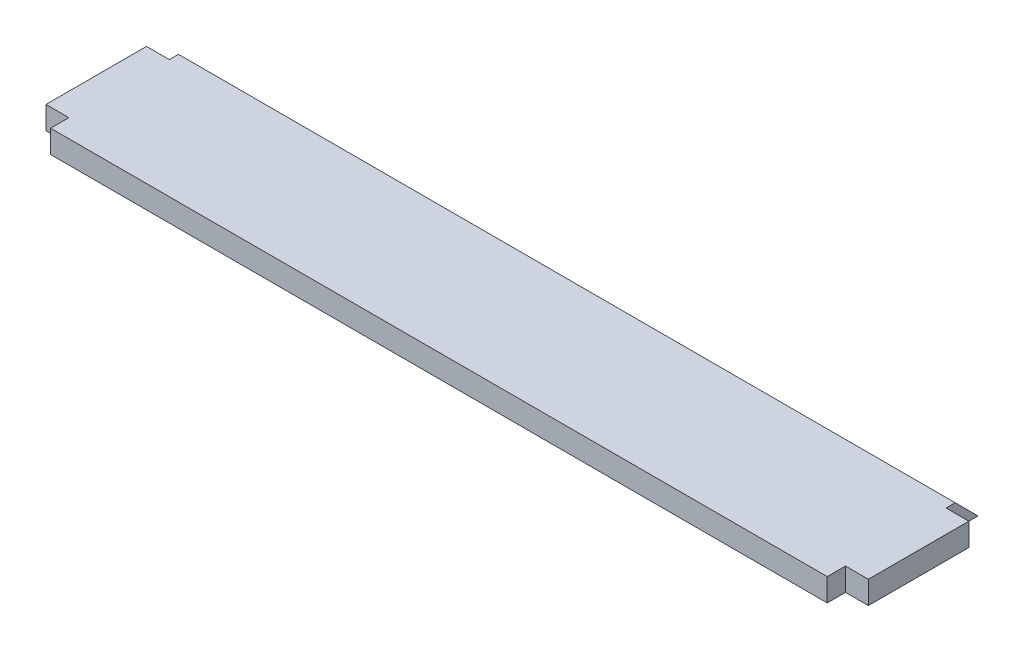
from build123d import *

# Parameters (mm, degrees)
SKETCH2_W           = 170
SKETCH2_H           = 35
BOSS_EXTRUDE1_DEPTH = 5
CUT_EXTRUDE1_DEPTH  = 200
SKETCH5_W           = 22
SKETCH5_H           = 5
BOSS_EXTRUDE2_DEPTH = 5
SKETCH6_W           = 22
SKETCH6_H           = 5
BOSS_EXTRUDE3_DEPTH = 5
CUT_EXTRUDE2_DEPTH  = 563


with BuildPart() as part:
    # Sketch2 → Boss-Extrude1 (new body)
    with BuildSketch(Plane(origin=(0, 0, 0), x_dir=(1, 0, 0), z_dir=(0, 1, 0))):
        Rectangle(SKETCH2_W, SKETCH2_H)
    extrude(amount=BOSS_EXTRUDE1_DEPTH)

    # Sketch4 → Cut-Extrude1 (cut)
    with BuildSketch(Plane.ZY.offset(85)):
        Polygon((-17.5, 0), (-12.5, 5), (-17.5, 5), align=None)
    extrude(amount=-CUT_EXTRUDE1_DEPTH, mode=Mode.SUBTRACT)

    # Sketch5 → Boss-Extrude2 (add)
    with BuildSketch(Plane.ZY.offset(85)):
        with Locations((2.5, 2.5)):
            Rectangle(SKETCH5_W, SKETCH5_H)
    extrude(amount=BOSS_EXTRUDE2_DEPTH)

    # Sketch6 → Boss-Extrude3 (add)
    with BuildSketch(Plane(origin=(85, 0, 0), x_dir=(0, 0, -1), z_dir=(1, 0, 0))):
        with Locations((-2.5, 2.5)):
            Rectangle(SKETCH6_W, SKETCH6_H)
    extrude(amount=BOSS_EXTRUDE3_DEPTH)

    # Sketch7 → Cut-Extrude2 (cut)
    with BuildSketch(Plane(origin=(85, 0, 0), x_dir=(0, 0, -1), z_dir=(1, 0, 0))):
        Polygon((12.5, 5), (10.5, 5), (15.5, 0), (17.5, 0), align=None)
    extrude(amount=-CUT_EXTRUDE2_DEPTH, mode=Mode.SUBTRACT)


solid = part.part
